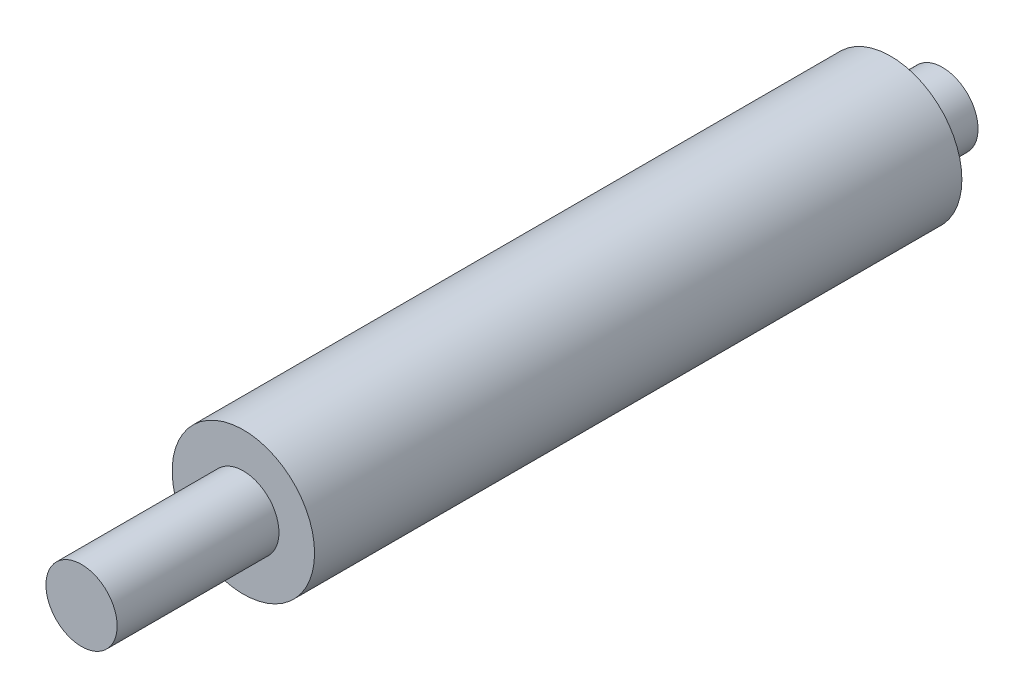
from build123d import *

# Parameters (mm, degrees)
SKETCH2_R           = 2.2
BOSS_EXTRUDE1_DEPTH = 20
SKETCH3_R           = 1.1
BOSS_EXTRUDE2_DEPTH = 5
BOSS_EXTRUDE3_START = 1.6
SKETCH4_R           = 1.1
BOSS_EXTRUDE3_DEPTH = 1.6


with BuildPart() as part:
    # Sketch2 → Boss-Extrude1 (new body)
    with BuildSketch(Plane.XY):
        Circle(SKETCH2_R)
    extrude(amount=BOSS_EXTRUDE1_DEPTH)

    # Sketch3 → Boss-Extrude2 (add)
    with BuildSketch(Plane.XY.offset(20)):
        Circle(SKETCH3_R)
    extrude(amount=BOSS_EXTRUDE2_DEPTH)

    # Sketch4 → Boss-Extrude3 (add)
    with BuildSketch(Plane(origin=(0, 0, 0), x_dir=(-1, 0, 0), z_dir=(0, 0, -1)).offset(BOSS_EXTRUDE3_START)):
        with Locations(Location((0, 0, 0), (0, 0, 180))):
            Circle(SKETCH4_R)
    extrude(amount=-BOSS_EXTRUDE3_DEPTH)


solid = part.part
